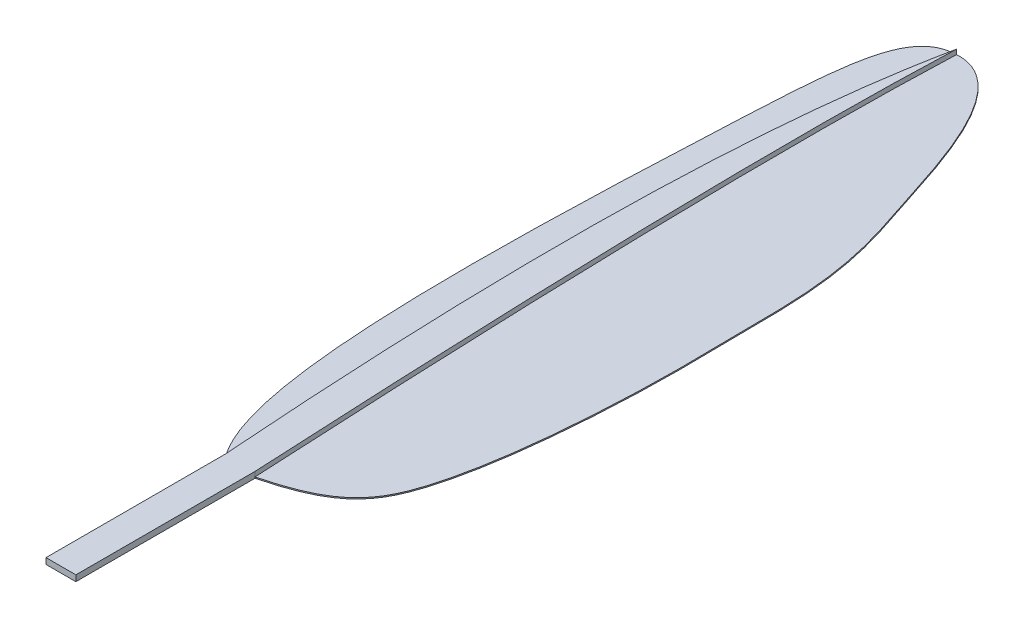
from build123d import *

# Parameters (mm, degrees)
BOSS_EXTRUDE1_DEPTH = 1
BOSS_EXTRUDE2_DEPTH = 0.2


with BuildPart() as part:
    # Sketch2 → Boss-Extrude1 (new body)
    with BuildSketch(Plane(origin=(0, 0, 0), x_dir=(1, 0, 0), z_dir=(0, 1, 0))):
        with BuildLine():
            add(Edge.make_bspline(
                [(-2.5, 0), (-8.331510312, 79.88522278), (0, 120)],
                knots=[0, 0, 0, 1, 1, 1], degree=2))
            Line((-2.5, 0), (-2.5, -30))
            Line((-2.5, -30), (2.5, -30))
            Line((2.5, -30), (2.5, 0))
            add(Edge.make_bspline(
                [(2.5, 0), (-1.639184348, 79.830180153), (0, 120)],
                knots=[0, 0, 0, 1, 1, 1], degree=2))
        make_face()
    extrude(amount=BOSS_EXTRUDE1_DEPTH)

    # Sketch2<4> → Boss-Extrude2 (add)
    with BuildSketch(Plane(origin=(0, 0, 0), x_dir=(1, 0, 0), z_dir=(0, 1, 0))):
        with BuildLine():
            add(Edge.make_bspline(
                [(0, 120), (-7.357536045, 119.756200735), (-8.169498702, 106.932489896), (-11.378400572, 37.613830712), (-9.557728223, 8.38325723), (-2.5, 0)],
                knots=[0, 0, 0, 0, 0.317116432, 0.417116432, 1, 1, 1, 1], degree=3))
            add(Edge.make_bspline(
                [(-2.5, 0), (-8.331510312, 79.88522278), (0, 120)],
                knots=[0, 0, 0, 1, 1, 1], degree=2))
        make_face()
        with BuildLine():
            add(Edge.make_bspline(
                [(2.5, 0), (12.9304115, 2.647924931), (20.632801908, 11.661745986), (22.521772468, 44.689576489), (22.054090643, 66.95313914), (22.561044514, 78.147908735), (15.352154478, 99.084267368), (8.942412889, 120.567138422), (0, 120)],
                knots=[0, 0, 0, 0, 0.15609962, 0.39468135, 0.460940872, 0.752435315, 0.809984908, 1, 1, 1, 1], degree=3))
            add(Edge.make_bspline(
                [(2.5, 0), (-1.639184348, 79.830180153), (0, 120)],
                knots=[0, 0, 0, 1, 1, 1], degree=2))
        make_face()
    extrude(amount=BOSS_EXTRUDE2_DEPTH)


solid = part.part
